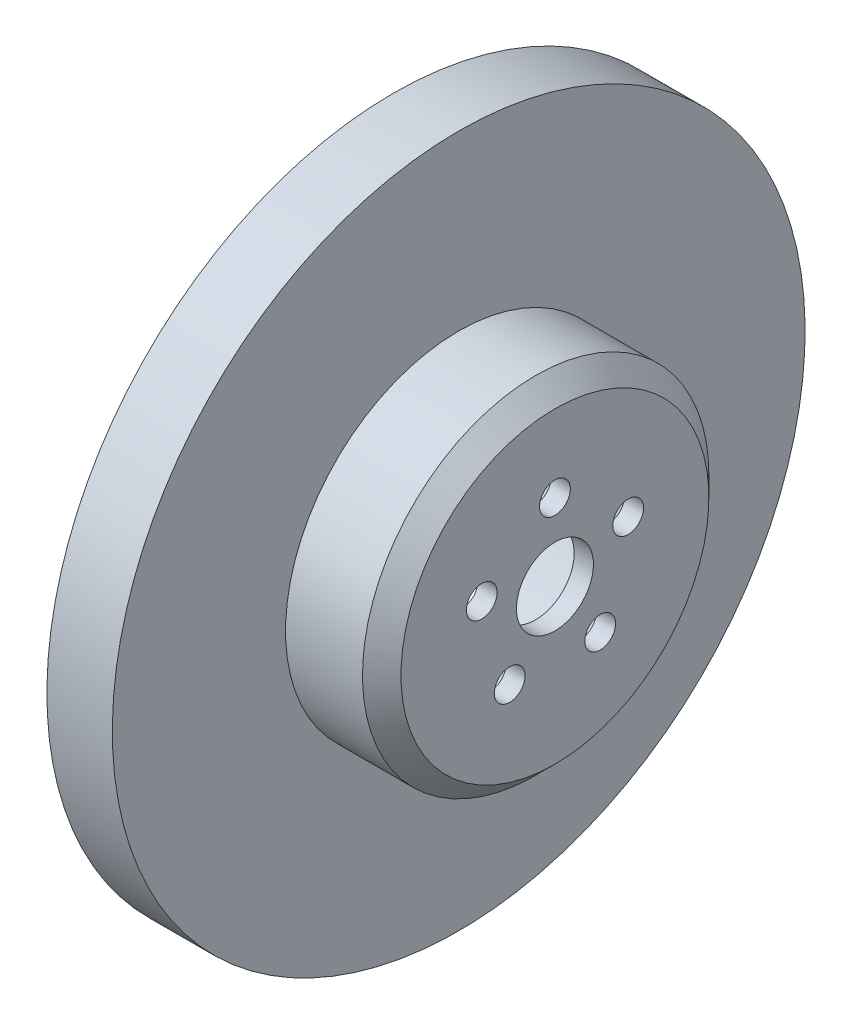
from build123d import *

# Parameters (mm, degrees)
SCHIZZO3_R                  = 8
TAGLIO_ESTRUSIONE1_DEPTH    = 282.879406839
RIPETIZIONECIRCOLARE1_COUNT = 5
SMUSSO1_SIZE                = 10


with BuildPart() as part:
    # Schizzo2 → Rivoluzione1 (revolve)
    with BuildSketch(Plane.XY):
        Polygon((0, 0), (0, 70), (-50, 70), (-50, 160), (-84, 160), (-84, 60), (-10, 60), (-10, 0), align=None)
    revolve(axis=Axis((50, -20, 0), (-1, 0, 0)))

    # Schizzo3 → Taglio-Estrusione1 (cut, through all)
    with BuildSketch(Plane(origin=(0, 0, 0), x_dir=(0, 0, -1), z_dir=(1, 0, 0))):
        with Locations(Location((0, 20, 0), (0, 0, 90))):
            Circle(SCHIZZO3_R)
    taglio_estrusione1 = extrude(amount=-TAGLIO_ESTRUSIONE1_DEPTH, mode=Mode.SUBTRACT)

    # RipetizioneCircolare1: Taglio-Estrusione1 ×5 about axis
    ripetizionecircolare1_axis = Axis((0, -20, 0), (1, 0, 0))
    for i in range(1, RIPETIZIONECIRCOLARE1_COUNT):
        add(taglio_estrusione1.rotate(ripetizionecircolare1_axis, i * 360 / RIPETIZIONECIRCOLARE1_COUNT), mode=Mode.SUBTRACT)

    # Smusso1
    smusso1_edges = [part.edges().sort_by_distance(p)[0] for p in [
        (0, -110, 0),
    ]]
    chamfer(smusso1_edges, length=SMUSSO1_SIZE)


solid = part.part
